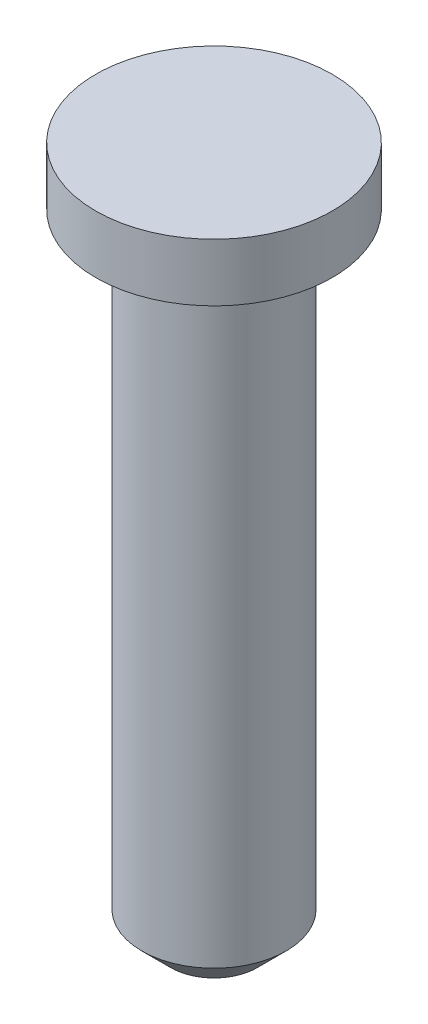
from build123d import *

# Parameters (mm, degrees)
CHAFL_N1_SIZE = 0.5


with BuildPart() as part:
    # Croquis1 → Revolución1 (revolve)
    with BuildSketch(Plane.XY, mode=Mode.PRIVATE) as revoluci_n1_sk:
        Polygon((0, 0), (2.05, 0), (2.05, -1), (1.25, -1), (1.25, -12), (0, -12), align=None)
    revolve(revoluci_n1_sk.sketch.rotate(Axis((0, 0, 0), (0, -1, 0)), 90), axis=Axis((0, 0, 0), (0, -1, 0)))

    # Chaflán1
    chafl_n1_edges = [part.edges().sort_by_distance(p)[0] for p in [
        (0, -12, -1.25),
    ]]
    chamfer(chafl_n1_edges, length=CHAFL_N1_SIZE)


solid = part.part
